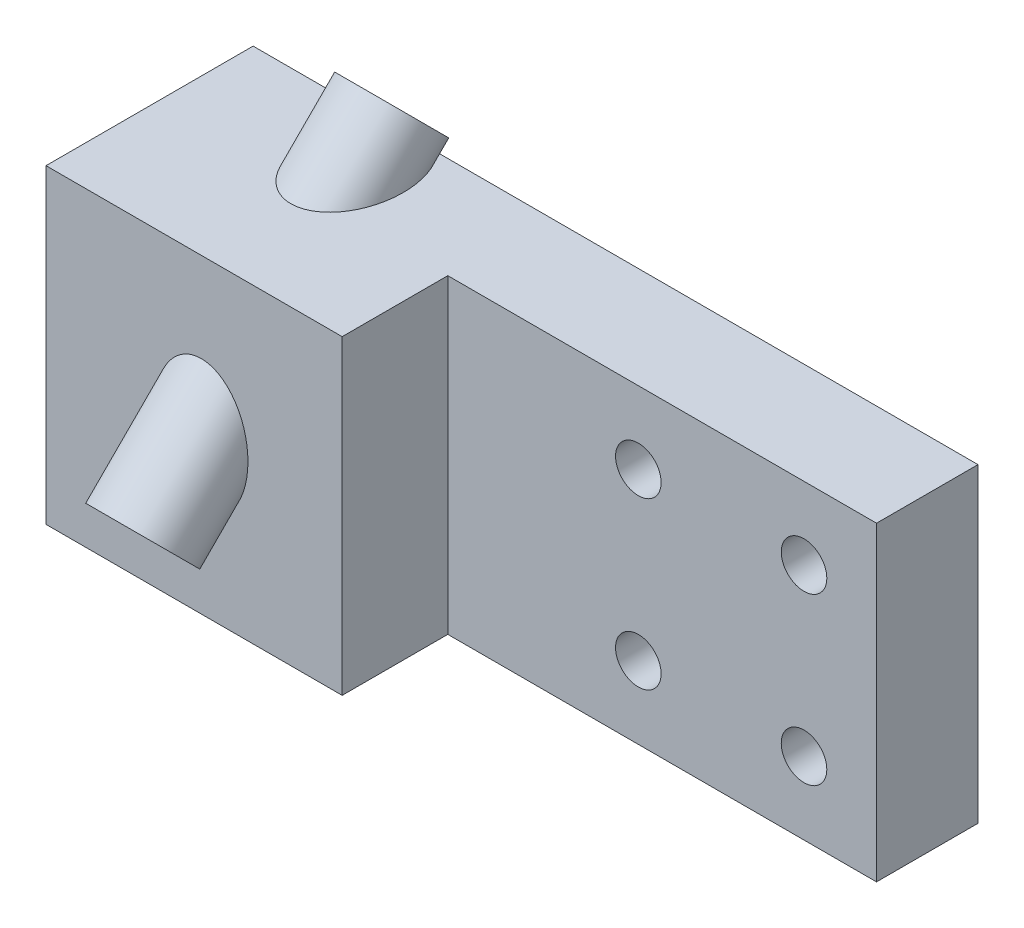
from build123d import *

# Parameters (mm, degrees)
SKETCH1_W            = 15
SKETCH1_H            = 15
SKETCH1_R            = 1.1
EXTRUDE1_DEPTH       = 4
EXTRUDE2_DEPTH       = 60
EXTRUDE2_DEPTH_BACK  = 4
SKETCH3_R            = 2
SKETCH4_R            = 1.75
EXTRUDE3_DEPTH       = 3
SKETCH5_R            = 2
EXTRUDE4_DEPTH       = 3
SKETCH6_W            = 35
SKETCH6_H            = 15
EXTRUDE5_DEPTH       = 10
SKETCH7_R            = 1.1
EXTRUDE6_DEPTH       = 29
EXTRUDE7_DEPTH       = 29
SKETCH_1_R           = 1.5
CUT_EXTRUDE_1_DEPTH  = 13
SKETCH_2_W           = 60.814436428
SKETCH_2_H           = 56.653731681
CUT_EXTRUDE_2_DEPTH  = 13
EXTRUDE_1_DEPTH      = 4
EXTRUDE_1_DEPTH_BACK = 13
SKETCH_4_R           = 2.25
SKETCH_4_R_2         = 1.5
SKETCH_5_W           = 18.7
SKETCH_5_H           = 1
CUT_EXTRUDE_3_DEPTH  = 21
SKETCH_6_W           = 18.7
SKETCH_6_H           = 1.9
CUT_EXTRUDE_4_DEPTH  = 21
SKETCH_7_W           = 5.1
SKETCH_7_H           = 15
CUT_EXTRUDE_5_DEPTH  = 2


with BuildPart() as part:
    # Sketch1 → Extrude1 (new body)
    with BuildSketch(Plane.XY):
        with Locations((7.5, -7.5)):
            Rectangle(SKETCH1_W, SKETCH1_H)
        with Locations((3.5, -3.5)):
            Circle(SKETCH1_R, mode=Mode.SUBTRACT)
        with Locations((11.5, -3.5)):
            Circle(SKETCH1_R, mode=Mode.SUBTRACT)
        with Locations((11.5, -11.5)):
            Circle(SKETCH1_R, mode=Mode.SUBTRACT)
        with Locations((3.5, -11.5)):
            Circle(SKETCH1_R, mode=Mode.SUBTRACT)
    extrude(amount=EXTRUDE1_DEPTH)

    # Sketch3 → Extrude2 (add, two sides: drawn at the far end of the back side and taken through both)
    with BuildSketch(Plane(origin=(0, -5.75, 5.75), x_dir=(1, 0, 0), z_dir=(0, -0.7071067811865488, 0.7071067811865464)).offset(-EXTRUDE2_DEPTH_BACK)):
        with Locations(Location((7.5, -2.474873734, 0), (0, 0, 270))):
            Circle(SKETCH3_R)
    extrude(amount=EXTRUDE2_DEPTH + EXTRUDE2_DEPTH_BACK)

    # Sketch4 → Extrude3 (add)
    with BuildSketch(Plane(origin=(0, -48.176406871, 48.176406871), x_dir=(1, 0, 0), z_dir=(0, -0.7071067811865487, 0.7071067811865465))):
        with Locations(Location((7.5, -2.474873734, 0), (0, 0, 90))):
            Circle(SKETCH4_R)
    extrude(amount=EXTRUDE3_DEPTH)

    # Sketch5 → Extrude4 (add)
    with BuildSketch(Plane(origin=(0, -50.297727215, 50.297727215), x_dir=(-1, 0, 0), z_dir=(0, -0.7071067811865486, 0.7071067811865465))):
        with Locations(Location((-7.5, 2.474873734, 0), (0, 0, 90))):
            Circle(SKETCH5_R)
    extrude(amount=EXTRUDE4_DEPTH)

    # Sketch6 → Extrude5 (add)
    with BuildSketch(Plane.XY.offset(4)):
        with Locations((17.5, -7.5)):
            Rectangle(SKETCH6_W, SKETCH6_H)
    extrude(amount=-EXTRUDE5_DEPTH)

    # Sketch7 → Extrude6 (cut)
    with BuildSketch(Plane.XY.offset(4)):
        with Locations((31.5, -3.5)):
            Circle(SKETCH7_R)
        with Locations((31.5, -11.5)):
            Circle(SKETCH7_R)
        with Locations((23.5, -11.5)):
            Circle(SKETCH7_R)
        with Locations((23.5, -3.5)):
            Circle(SKETCH7_R)
    extrude(amount=-EXTRUDE6_DEPTH, mode=Mode.SUBTRACT)

    # Sketch8 → Extrude7 (cut)
    with BuildSketch(Plane(origin=(0, -15, 0), x_dir=(-1, 0, 0), z_dir=(0, -1, 0))):
        Polygon((-35, 1.1), (-35, 1), (-35, -1.1), (-16.3, -1.1), (-16.3, 1.1), align=None)
    extrude(amount=-EXTRUDE7_DEPTH, mode=Mode.SUBTRACT)

    # 草图1 → 切除-拉伸1 (cut)
    with BuildSketch(Plane(origin=(0, -5.75, 5.75), x_dir=(1, 0, 0), z_dir=(0, -0.7071067811865488, 0.7071067811865464))):
        with Locations(Location((7.5, -2.474873734, 0), (0, 0, 270))):
            Circle(SKETCH_1_R)
    extrude(amount=-CUT_EXTRUDE_1_DEPTH, mode=Mode.SUBTRACT)

    # 草图2 → 切除-拉伸2 (cut)
    with BuildSketch(Plane.ZY):
        with Locations((34.407218214, -28.326865841)):
            Rectangle(SKETCH_2_W, SKETCH_2_H)
    extrude(amount=-CUT_EXTRUDE_2_DEPTH, mode=Mode.SUBTRACT)

    # 草图4 → 凸台-拉伸1 (add, two sides: drawn at the far end of the back side and taken through both)
    with BuildSketch(Plane(origin=(0, -5.75, 5.75), x_dir=(1, 0, 0), z_dir=(0, -0.7071067811865488, 0.7071067811865464)).offset(-EXTRUDE_1_DEPTH_BACK)):
        with Locations(Location((7.5, -2.474873734, 0), (0, 0, 270))):
            Circle(SKETCH_4_R)
        with Locations(Location((7.5, -2.474873734, 0), (0, 0, 270))):
            Circle(SKETCH_4_R_2, mode=Mode.SUBTRACT)
    extrude(amount=EXTRUDE_1_DEPTH + EXTRUDE_1_DEPTH_BACK)

    # 草图5 → 切除-拉伸3 (cut)
    with BuildSketch(Plane(origin=(0, -15, 0), x_dir=(-1, 0, 0), z_dir=(0, -1, 0))):
        with Locations((-25.65, -1.6)):
            Rectangle(SKETCH_5_W, SKETCH_5_H)
    extrude(amount=-CUT_EXTRUDE_3_DEPTH, mode=Mode.SUBTRACT)

    # 草图6 → 切除-拉伸4 (cut)
    with BuildSketch(Plane(origin=(0, -15, 0), x_dir=(-1, 0, 0), z_dir=(0, -1, 0))):
        with Locations((-25.65, -3.05)):
            Rectangle(SKETCH_6_W, SKETCH_6_H)
    extrude(amount=-CUT_EXTRUDE_4_DEPTH, mode=Mode.SUBTRACT)

    # 草图7 → 切除-拉伸5 (cut)
    with BuildSketch(Plane(origin=(16.3, 0, 0), x_dir=(0, 0, -1), z_dir=(1, 0, 0))):
        with Locations((-1.45, -7.5)):
            Rectangle(SKETCH_7_W, SKETCH_7_H)
    extrude(amount=-CUT_EXTRUDE_5_DEPTH, mode=Mode.SUBTRACT)


solid = part.part
